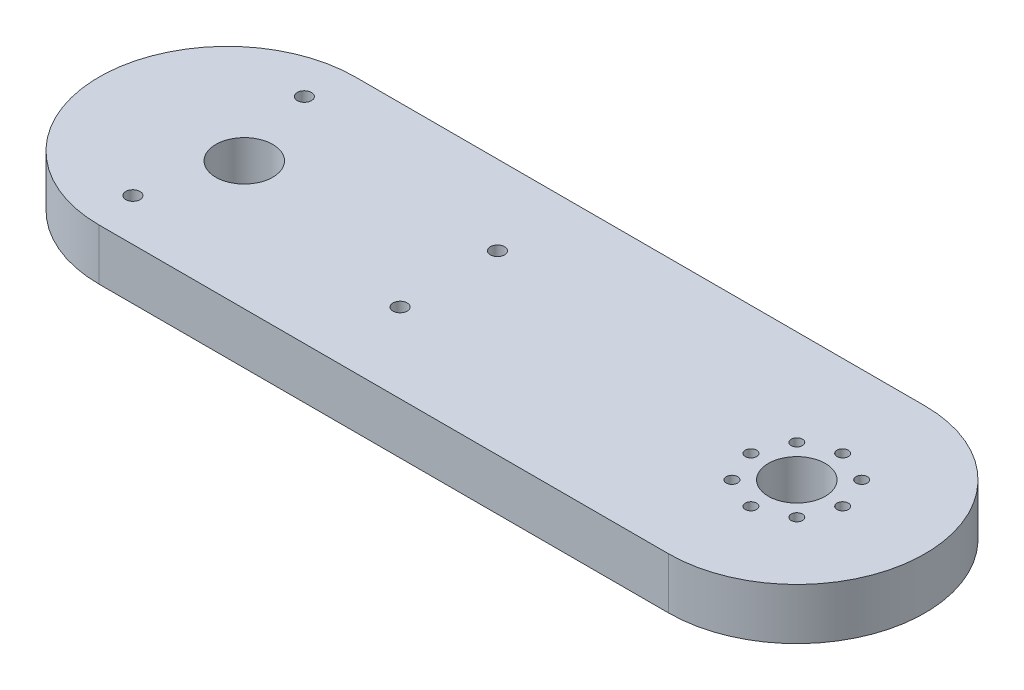
from build123d import *

# Parameters (mm, degrees)
BOSS_EXTRUDE1_DEPTH     = 4.5
CUT_EXTRUDE1_DEPTH      = 77.442789065
CUT_EXTRUDE1_DEPTH_BACK = 77.442789065
SKETCH3_R               = 0.99
SKETCH4_R               = 5
CUT_EXTRUDE2_DEPTH      = 77.442789065
CUT_EXTRUDE3_DEPTH      = 77.442789065
CUT_EXTRUDE3_DEPTH_BACK = 77.442789065
SKETCH5_R               = 1.25
SKETCH5_R_2             = 5


with BuildPart() as part:
    # Sketch2 → Boss-Extrude1 (new, symmetric)
    with BuildSketch(Plane(origin=(0, 0, 0), x_dir=(1, 0, 0), z_dir=(0, 1, 0))):
        with BuildLine():
            Line((50, -22.5), (-50, -22.5))
            ThreePointArc((-50, -22.5), (-72.5, 0), (-50, 22.5))
            Line((-50, 22.5), (50, 22.5))
            ThreePointArc((50, 22.5), (72.5, 0), (50, -22.5))
        make_face()
    extrude(amount=BOSS_EXTRUDE1_DEPTH, both=True)

    # Sketch3 → Cut-Extrude1 (cut, two sides: drawn at the far end of the back side and taken through both)
    with BuildSketch(Plane(origin=(0, 4.5, 0), x_dir=(1, 0, 0), z_dir=(0, 1, 0)).offset(-CUT_EXTRUDE1_DEPTH_BACK)):
        with Locations(Location((41.95, 0, 0), (0, 0, 270))):
            Circle(SKETCH3_R)
        with Locations(Location((44.307790411, 5.692209589, 0), (0, 0, 270))):
            Circle(SKETCH3_R)
        with Locations(Location((50, 8.05, 0), (0, 0, 270))):
            Circle(SKETCH3_R)
        with Locations(Location((55.692209589, 5.692209589, 0), (0, 0, 270))):
            Circle(SKETCH3_R)
        with Locations(Location((58.05, 0, 0), (0, 0, 270))):
            Circle(SKETCH3_R)
        with Locations(Location((55.692209589, -5.692209589, 0), (0, 0, 270))):
            Circle(SKETCH3_R)
        with Locations(Location((50, -8.05, 0), (0, 0, 270))):
            Circle(SKETCH3_R)
        with Locations(Location((44.307790411, -5.692209589, 0), (0, 0, 270))):
            Circle(SKETCH3_R)
    extrude(amount=CUT_EXTRUDE1_DEPTH + CUT_EXTRUDE1_DEPTH_BACK, mode=Mode.SUBTRACT)

    # Sketch4 → Cut-Extrude2 (cut, through all)
    with BuildSketch(Plane(origin=(0, 4.5, 0), x_dir=(1, 0, 0), z_dir=(0, 1, 0))):
        with Locations(Location((50, 0, 0), (0, 0, 270))):
            Circle(SKETCH4_R)
    extrude(amount=-CUT_EXTRUDE2_DEPTH, mode=Mode.SUBTRACT)

    # Sketch5 → Cut-Extrude3 (cut, two sides: drawn at the far end of the back side and taken through both)
    with BuildSketch(Plane(origin=(0, 4.5, 0), x_dir=(1, 0, 0), z_dir=(0, 1, 0)).offset(-CUT_EXTRUDE3_DEPTH_BACK)):
        with Locations(Location((-51.5, -15.05, 0), (0, 0, 270))):
            Circle(SKETCH5_R)
        with Locations(Location((-51.5, 15.05, 0), (0, 0, 270))):
            Circle(SKETCH5_R)
        with Locations(Location((-11.1, 8.55, 0), (0, 0, 270))):
            Circle(SKETCH5_R)
        with Locations(Location((-11.1, -8.55, 0), (0, 0, 270))):
            Circle(SKETCH5_R)
        with Locations(Location((-47, 0, 0), (0, 0, 270))):
            Circle(SKETCH5_R_2)
    extrude(amount=CUT_EXTRUDE3_DEPTH + CUT_EXTRUDE3_DEPTH_BACK, mode=Mode.SUBTRACT)


solid = part.part
